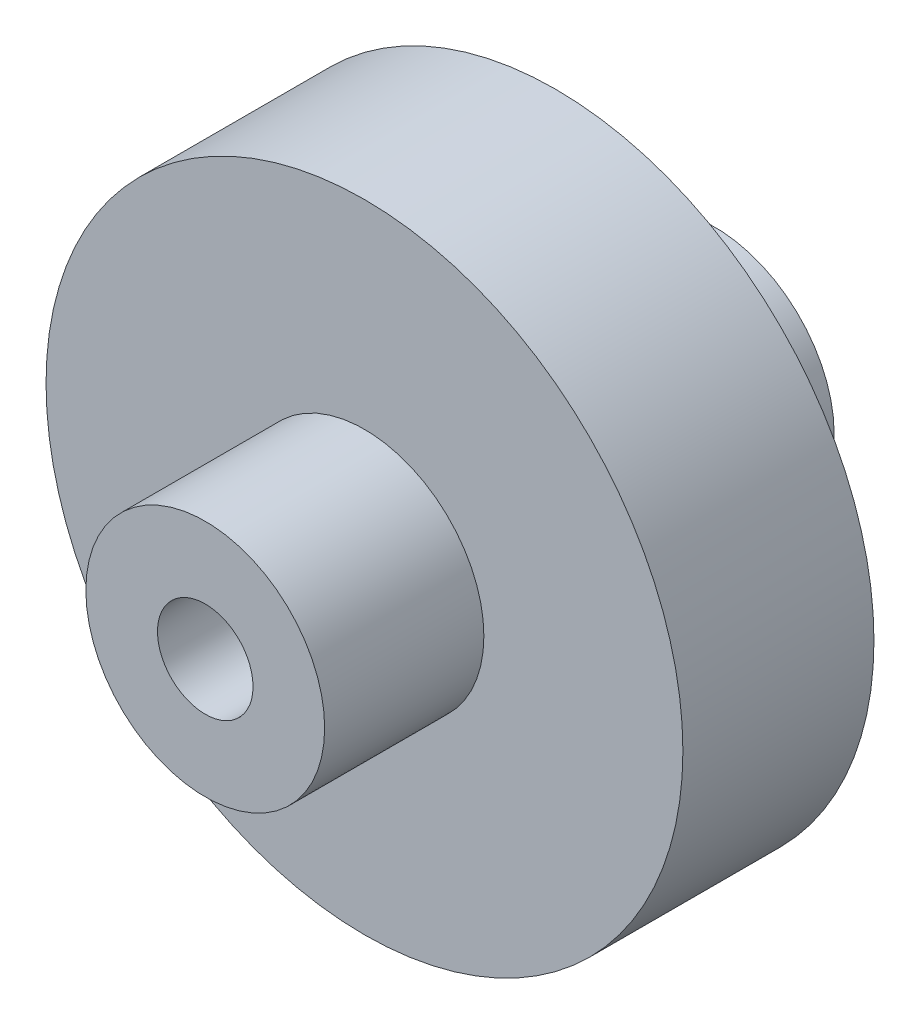
from build123d import *

# Parameters (mm, degrees)
SKETCH1_R           = 20
BOSS_EXTRUDE1_DEPTH = 32
SKETCH2_R           = 3
CUT_EXTRUDE1_DEPTH  = 32
CUT_EXTRUDE2_START  = -10
SKETCH3_R           = 20
SKETCH3_R_2         = 7.5
CUT_EXTRUDE2_DEPTH  = 10
SKETCH4_R           = 20
SKETCH4_R_2         = 7.5
CUT_EXTRUDE3_DEPTH  = 10
CUT_EXTRUDE4_START  = -7
SKETCH6_W           = 2
SKETCH6_H           = 4.833484819
CUT_EXTRUDE4_DEPTH  = 2


with BuildPart() as part:
    # Sketch1 → Boss-Extrude1 (new body)
    with BuildSketch(Plane.XY):
        Circle(SKETCH1_R)
    extrude(amount=BOSS_EXTRUDE1_DEPTH)

    # Sketch2 → Cut-Extrude1 (cut)
    with BuildSketch(Plane.XY.offset(32)):
        Circle(SKETCH2_R)
    extrude(amount=-CUT_EXTRUDE1_DEPTH, mode=Mode.SUBTRACT)

    # Sketch3 → Cut-Extrude2 (cut)
    with BuildSketch(Plane.XY.offset(32).offset(CUT_EXTRUDE2_START)):
        Circle(SKETCH3_R)
        Circle(SKETCH3_R_2, mode=Mode.SUBTRACT)
    extrude(amount=CUT_EXTRUDE2_DEPTH, mode=Mode.SUBTRACT)

    # Sketch4 → Cut-Extrude3 (cut)
    with BuildSketch(Plane(origin=(0, 0, 0), x_dir=(-1, 0, 0), z_dir=(0, 0, -1))):
        Circle(SKETCH4_R)
        with Locations(Location((0, 0, 0), (0, 0, 180))):
            Circle(SKETCH4_R_2, mode=Mode.SUBTRACT)
    extrude(amount=-CUT_EXTRUDE3_DEPTH, mode=Mode.SUBTRACT)

    # Sketch6 → Cut-Extrude4 (cut)
    with BuildSketch(Plane.XY.offset(32).offset(CUT_EXTRUDE4_START)):
        with Locations((0.206120499, 4.959454821)):
            Rectangle(SKETCH6_W, SKETCH6_H)
    extrude(amount=-CUT_EXTRUDE4_DEPTH, mode=Mode.SUBTRACT)


solid = part.part
